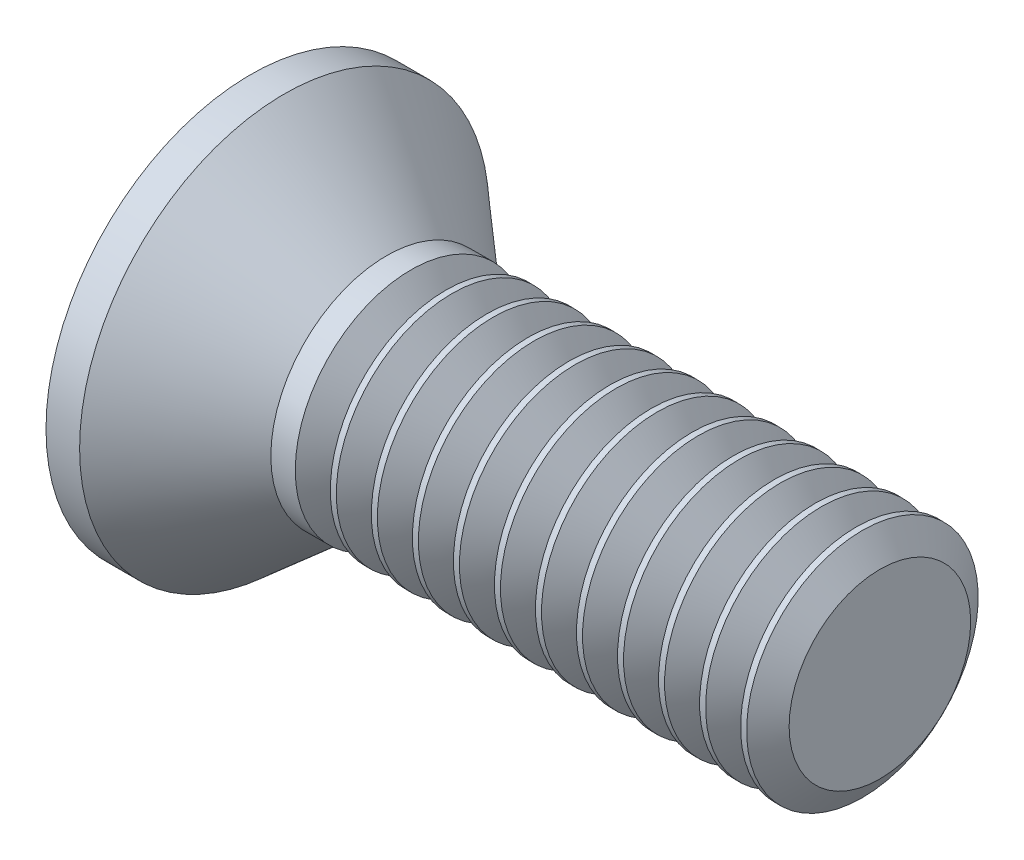
from build123d import *

# Parameters (mm, degrees)
CIRPATTERN1_COUNT = 2
CIRPATTERN1_ANGLE = 90
THDSCHPAT_COUNT   = 12
THDSCHPAT_PITCH   = 0.621145455


with BuildPart() as part:
    # BodySke → Base-Revolve (revolve)
    with BuildSketch(Plane.XY, mode=Mode.PRIVATE) as base_revolve_sk:
        Polygon((0, 0), (0, 3.0988), (0.50877405, 3.0988), (2.0574, 1.7526), (9.525, 1.7526), (9.525, 0), align=None)
    revolve(base_revolve_sk.sketch.rotate(Axis((-6.35, 0, 0), (1, 0, 0)), 90), axis=Axis((-6.35, 0, 0), (1, 0, 0)))

    # Sketch3 → Cross section 0
    with BuildSketch(Plane.ZY):
        with BuildLine():
            Line((-0.4826, 2.4765), (0.4826, 2.4765))
            Line((0.4826, 2.4765), (0.4826, -2.4765))
            Line((0.4826, -2.4765), (-0.4826, -2.4765))
            Line((-0.4826, -2.4765), (-0.4826, 2.4765))
        make_face()
    # Sketch4 → Cross section 1
    with BuildSketch(Plane.ZY.offset(-2.8702)):
        with BuildLine():
            Line((-0.2413, 0.2413), (0.2413, 0.2413))
            Line((0.2413, 0.2413), (0.2413, -0.2413))
            Line((0.2413, -0.2413), (-0.2413, -0.2413))
            Line((-0.2413, -0.2413), (-0.2413, 0.2413))
        make_face()
    cross = loft(mode=Mode.SUBTRACT)

    # CirPattern1: Cross ×2 about axis
    cirpattern1_axis = Axis((0, 0, 0), (1, 0, 0))
    for i in range(1, CIRPATTERN1_COUNT):
        add(cross.rotate(cirpattern1_axis, i * CIRPATTERN1_ANGLE / (CIRPATTERN1_COUNT - 1)), mode=Mode.SUBTRACT)

    # ThdSchSke → ThreadSchematic (revolve, cut)
    with BuildSketch(Plane.XY):
        Polygon((2.6924254, -1.37414), (2.427424855, -1.7526), (2.427424855, -2.19075), (2.957425945, -2.19075), (2.957425945, -1.7526), align=None)
    threadschematic = revolve(axis=Axis((-3.175, 0, 0), (1, 0, 0)), mode=Mode.SUBTRACT)

    # ThdSchPat: ThreadSchematic ×12
    with Locations(*[(i * THDSCHPAT_PITCH, 0, 0) for i in range(1, THDSCHPAT_COUNT)]):
        add(threadschematic, mode=Mode.SUBTRACT)


solid = part.part
